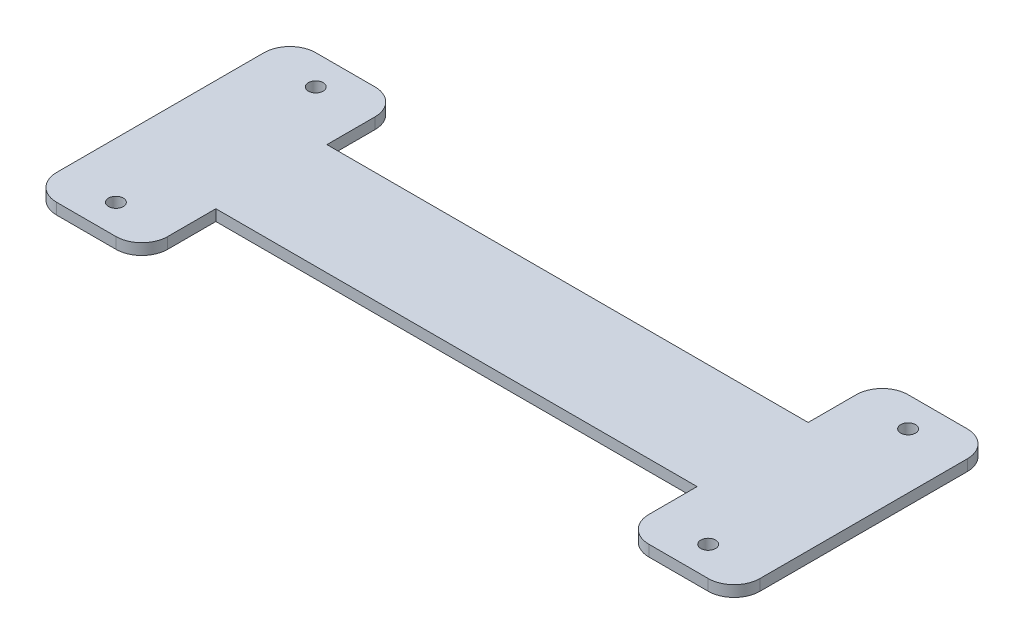
from build123d import *

# Parameters (mm, degrees)
CROQUIS1_W              = 190
CROQUIS1_H              = 70
SALIENTE_EXTRUIR1_DEPTH = 3
CROQUIS2_R              = 2
CROQUIS2_W              = 130
CROQUIS2_H              = 20
CORTAR_EXTRUIR1_DEPTH   = 3
REDONDEO1_R             = 7


with BuildPart() as part:
    # Croquis1 → Saliente-Extruir1 (new body)
    with BuildSketch(Plane(origin=(0, 0, 0), x_dir=(1, 0, 0), z_dir=(0, 1, 0))):
        with Locations((95, -35)):
            Rectangle(CROQUIS1_W, CROQUIS1_H)
    extrude(amount=SALIENTE_EXTRUIR1_DEPTH)

    # Croquis2 → Cortar-Extruir1 (cut)
    with BuildSketch(Plane(origin=(0, 3, 0), x_dir=(1, 0, 0), z_dir=(0, 1, 0))):
        with Locations(Location((15, -8, 0), (0, 0, 270))):
            Circle(CROQUIS2_R)
        with Locations(Location((175, -8, 0), (0, 0, 270))):
            Circle(CROQUIS2_R)
        with Locations(Location((175, -62, 0), (0, 0, 270))):
            Circle(CROQUIS2_R)
        with Locations(Location((15, -62, 0), (0, 0, 270))):
            Circle(CROQUIS2_R)
        with Locations((95, -10)):
            Rectangle(CROQUIS2_W, CROQUIS2_H)
        with Locations((95, -60)):
            Rectangle(CROQUIS2_W, CROQUIS2_H)
    extrude(amount=-CORTAR_EXTRUIR1_DEPTH, mode=Mode.SUBTRACT)

    # Redondeo1
    redondeo1_edges = [part.edges().sort_by_distance(p)[0] for p in [
        (30, 1.5, 70),
        (160, 1.5, 70),
        (30, 1.5, 0),
        (160, 1.5, 0),
        (0, 1.5, 0),
        (190, 1.5, 0),
        (190, 1.5, 70),
        (0, 1.5, 70),
    ]]
    fillet(redondeo1_edges, radius=REDONDEO1_R)


solid = part.part
